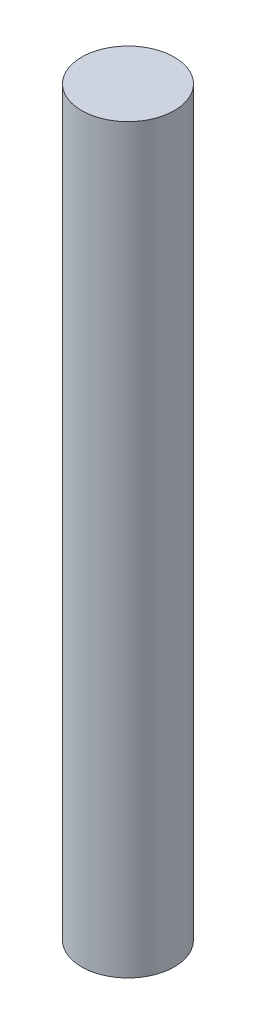
from build123d import *

# Parameters (mm, degrees)
SKETCH1_R           = 2
BOSS_EXTRUDE1_DEPTH = 32


with BuildPart() as part:
    # Sketch1 → Boss-Extrude1 (new body)
    with BuildSketch(Plane(origin=(0, 0, 0), x_dir=(1, 0, 0), z_dir=(0, 1, 0))):
        with Locations(Location((0, 0, 0), (0, 0, 270))):
            Circle(SKETCH1_R)
    extrude(amount=BOSS_EXTRUDE1_DEPTH)


solid = part.part
